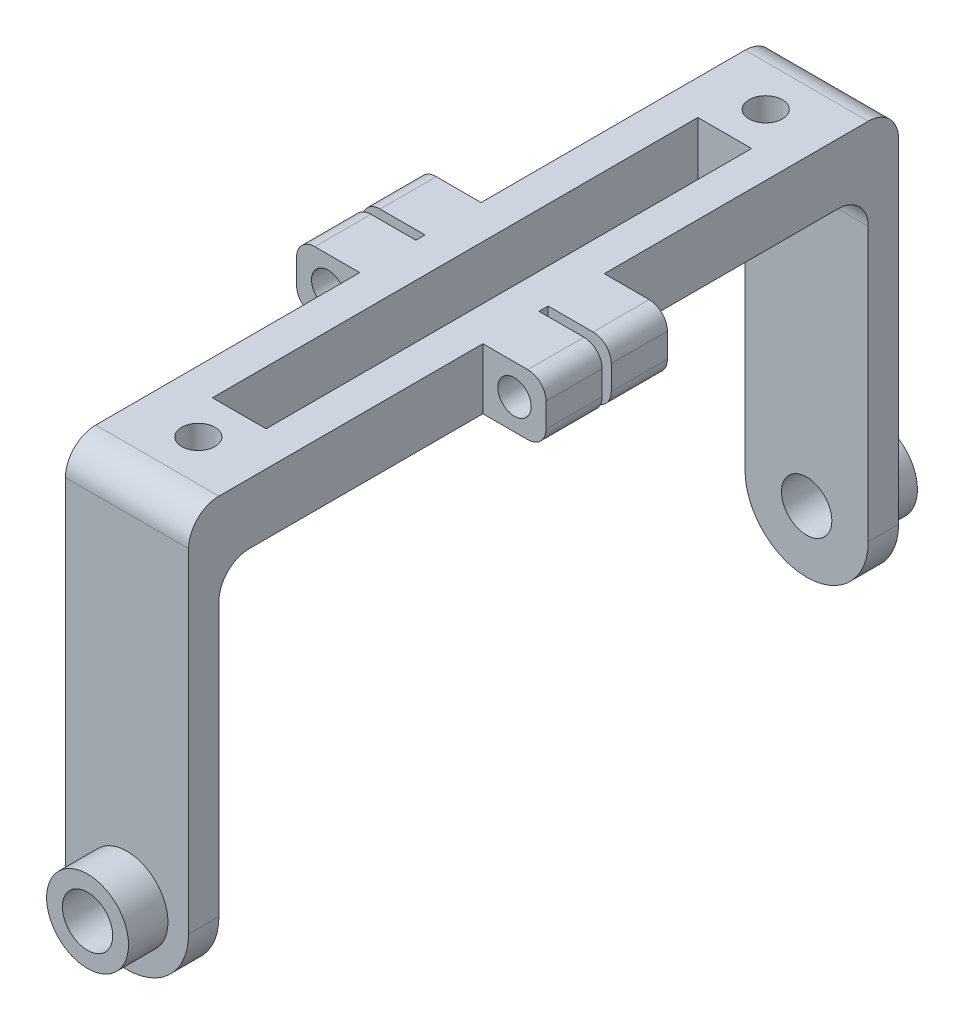
from build123d import *

# Parameters (mm, degrees)
SKETCH1_R               = 7.15
SKETCH1_R_2             = 4.15
BOSS_EXTRUDE1_DEPTH     = 5
SKETCH2_R               = 7.15
SKETCH2_R_2             = 4.15
BOSS_EXTRUDE2_DEPTH     = 5
BOSS_EXTRUDE3_START     = 1.5
SKETCH3_R               = 7.15
SKETCH3_R_2             = 4.15
BOSS_EXTRUDE3_DEPTH     = 1.5
SKETCH4_R               = 7.15
SKETCH4_R_2             = 4.15
BOSS_EXTRUDE4_DEPTH     = 1.5
SKETCH5_R               = 7.15
SKETCH5_R_2             = 4.15
BOSS_EXTRUDE5_DEPTH     = 5
BOSS_EXTRUDE6_START     = 5
SKETCH6_R               = 4.15
BOSS_EXTRUDE6_DEPTH     = 5
SKETCH7_W               = 20.3
SKETCH7_H               = 10
BOSS_EXTRUDE7_DEPTH     = 107
SKETCH8_R               = 4.15
CUT_EXTRUDE1_DEPTH      = 153.570131415
FILLET1_R               = 5
CUT_EXTRUDE3_DEPTH      = 18.9
SKETCH11_R              = 7.15
SKETCH11_R_2            = 6.75
CUT_EXTRUDE4_DEPTH      = 6.5
SKETCH12_R              = 7.15
SKETCH12_R_2            = 6.75
CUT_EXTRUDE5_DEPTH      = 6.5
CUT_EXTRUDE6_DEPTH      = 18.9
SKETCH14_W              = 9.25
SKETCH14_H              = 10
BOSS_EXTRUDE8_DEPTH     = 0.4
SKETCH15_W              = 9.25
SKETCH15_H              = 10
BOSS_EXTRUDE9_DEPTH     = 0.4
SKETCH17_W              = 9.25
SKETCH17_H              = 10
BOSS_EXTRUDE10_DEPTH    = 10
CUT_EXTRUDE7_DEPTH      = 26
SKETCH20_W              = 9.25
SKETCH20_H              = 10
BOSS_EXTRUDE11_DEPTH    = 10
CUT_EXTRUDE8_DEPTH      = 112.751968699
CUT_EXTRUDE8_DEPTH_BACK = 112.751968699
FILLET2_R               = 3
SKETCH23_W              = 117
SKETCH23_H              = 2
CUT_EXTRUDE9_DEPTH      = 37
SKETCH24_W              = 20.3
SKETCH24_H              = 5
BOSS_EXTRUDE12_DEPTH    = 22
SKETCH25_W              = 80
SKETCH25_H              = 10
CUT_EXTRUDE10_DEPTH     = 0.2
SKETCH26_W              = 80
SKETCH26_H              = 10
CUT_EXTRUDE11_DEPTH     = 0.2


with BuildPart() as part:
    # Sketch1 → Boss-Extrude1 (new body)
    with BuildSketch(Plane.XY):
        with Locations((-52, 0)):
            Circle(SKETCH1_R)
        with Locations((-52, 0)):
            Circle(SKETCH1_R_2, mode=Mode.SUBTRACT)
    extrude(amount=-BOSS_EXTRUDE1_DEPTH)

    # Sketch4 → Boss-Extrude4 (add)
    with BuildSketch(Plane(origin=(0, 0, -5), x_dir=(-1, 0, 0), z_dir=(0, 0, -1))):
        with Locations(Location((52, 0, 0), (0, 0, 180))):
            Circle(SKETCH4_R)
        with Locations(Location((52, 0, 0), (0, 0, 180))):
            Circle(SKETCH4_R_2, mode=Mode.SUBTRACT)
    extrude(amount=BOSS_EXTRUDE4_DEPTH)

    # Sketch5 → Boss-Extrude5 (add)
    # profile 1 of 6: a face of its own
    with BuildSketch(Plane(origin=(0, 0, -6.5), x_dir=(-1, 0, 0), z_dir=(0, 0, -1))):
        with Locations(Location((52, 0, 0), (0, 0, 180))):
            Circle(SKETCH5_R)
        with Locations(Location((52, 0, 0), (0, 0, 180))):
            Circle(SKETCH5_R_2, mode=Mode.SUBTRACT)
    # profile 2 of 6: a face of its own
    with BuildSketch(Plane(origin=(0, 0, -6.5), x_dir=(-1, 0, 0), z_dir=(0, 0, -1))):
        with BuildLine():
            ThreePointArc((44.85, 0), (52, 7.15), (59.15, 0))
            Line((59.15, 0), (62.15, 0))
            ThreePointArc((62.15, 0), (52, 10.15), (41.85, 0))
            Line((41.85, 0), (44.85, 0))
        make_face()
    # profile 3 of 6: a face of its own
    with BuildSketch(Plane(origin=(0, 0, -6.5), x_dir=(-1, 0, 0), z_dir=(0, 0, -1))):
        with BuildLine():
            Line((62.15, 0), (59.15, 0))
            ThreePointArc((59.15, 0), (52, -7.15), (44.85, 0))
            Line((44.85, 0), (41.85, 0))
            ThreePointArc((41.85, 0), (52, -10.15), (62.15, 0))
        make_face()
    # profile 4 of 6: a face of its own
    with BuildSketch(Plane(origin=(0, 0, -6.5), x_dir=(-1, 0, 0), z_dir=(0, 0, -1))):
        with BuildLine():
            ThreePointArc((44.85, 0), (52, 7.15), (59.15, 0))
            Line((59.15, 0), (62.15, 0))
            ThreePointArc((62.15, 0), (52, 10.15), (41.85, 0))
            Line((41.85, 0), (44.85, 0))
        make_face()
    # profile 5 of 6: a face of its own
    with BuildSketch(Plane(origin=(0, 0, -6.5), x_dir=(-1, 0, 0), z_dir=(0, 0, -1))):
        with BuildLine():
            Line((62.15, 0), (59.15, 0))
            ThreePointArc((59.15, 0), (52, -7.15), (44.85, 0))
            Line((44.85, 0), (41.85, 0))
            ThreePointArc((41.85, 0), (52, -10.15), (62.15, 0))
        make_face()
    # profile 6 of 6: a face of its own
    with BuildSketch(Plane(origin=(0, 0, -6.5), x_dir=(-1, 0, 0), z_dir=(0, 0, -1))):
        with BuildLine():
            ThreePointArc((41.85, 0), (52, 10.15), (62.15, 0))
            Line((62.15, 0), (62.15, 40))
            Line((62.15, 40), (41.85, 40))
            Line((41.85, 40), (41.85, 0))
        make_face()
    extrude(amount=BOSS_EXTRUDE5_DEPTH)



with BuildPart() as body_2:
    # Sketch2 → Boss-Extrude2 (new body)
    with BuildSketch(Plane.XY.offset(-125)):
        with Locations((-52, 0)):
            Circle(SKETCH2_R)
        with Locations((-52, 0)):
            Circle(SKETCH2_R_2, mode=Mode.SUBTRACT)
    extrude(amount=-BOSS_EXTRUDE2_DEPTH)

    # Sketch3 → Boss-Extrude3 (add)
    with BuildSketch(Plane.XY.offset(-125).offset(BOSS_EXTRUDE3_START)):
        with Locations((-52, 0)):
            Circle(SKETCH3_R)
        with Locations((-52, 0)):
            Circle(SKETCH3_R_2, mode=Mode.SUBTRACT)
    extrude(amount=-BOSS_EXTRUDE3_DEPTH)

    # Sketch6 → Boss-Extrude6 (add)
    with BuildSketch(Plane.XY.offset(-123.5).offset(BOSS_EXTRUDE6_START)):
        with BuildLine():
            Line((-62.15, 40), (-62.15, 0))
            ThreePointArc((-62.15, 0), (-52, -10.15), (-41.85, 0))
            Line((-41.85, 0), (-41.85, 40))
            Line((-41.85, 40), (-62.15, 40))
        make_face()
        with Locations((-52, 0)):
            Circle(SKETCH6_R, mode=Mode.SUBTRACT)
    extrude(amount=-BOSS_EXTRUDE6_DEPTH)


with BuildPart() as part_1:
    add(part.part)

    add(body_2.part)  # Boss-Extrude7 merges body 2
    # Sketch7 → Boss-Extrude7 (add)
    with BuildSketch(Plane.XY.offset(-118.5)):
        with Locations((-52, 35)):
            Rectangle(SKETCH7_W, SKETCH7_H)
    extrude(amount=BOSS_EXTRUDE7_DEPTH)

    # Sketch8 → Cut-Extrude1 (cut, through all)
    with BuildSketch(Plane(origin=(0, 40, 0), x_dir=(1, 0, 0), z_dir=(0, 1, 0))):
        with Locations(Location((-52, 65, 0), (0, 0, 270))):
            Circle(SKETCH8_R)
    extrude(amount=-CUT_EXTRUDE1_DEPTH, mode=Mode.SUBTRACT)

    # Fillet1
    fillet1_edges = [part_1.edges().sort_by_distance(p)[0] for p in [
        (-52, 40, -6.5),
        (-52, 30, -11.5),
        (-52, 30, -118.5),
        (-52, 40, -123.5),
    ]]
    fillet(fillet1_edges, radius=FILLET1_R)

    # Sketch10 → Cut-Extrude3 (cut)
    with BuildSketch(Plane(origin=(0, 40, 0), x_dir=(1, 0, 0), z_dir=(0, 1, 0))):
        with BuildLine():
            Line((-56.225, 65), (-56.225, 25))
            Line((-56.225, 25), (-47.775, 25))
            Line((-47.775, 25), (-47.775, 65))
            ThreePointArc((-47.775, 65), (-52, 60.775), (-56.225, 65))
        make_face()
        with BuildLine():
            Line((-56.225, 105), (-56.225, 65))
            ThreePointArc((-56.225, 65), (-52, 69.225), (-47.775, 65))
            Line((-47.775, 65), (-47.775, 105))
            Line((-47.775, 105), (-56.225, 105))
        make_face()
    extrude(amount=-CUT_EXTRUDE3_DEPTH, mode=Mode.SUBTRACT)


with BuildPart() as cut_extrude3_kept_piece:
    # of the separate pieces the step leaves, the one the design keeps (cut_extrude3_pieces_kept)
    add(part_1.part.solids().sort_by_distance((-41.85, 35, -123.5))[0])

    # Sketch11 → Cut-Extrude4 (cut)
    with BuildSketch(Plane.XY):
        with Locations((-52, 0)):
            Circle(SKETCH11_R)
        with Locations((-52, 0)):
            Circle(SKETCH11_R_2, mode=Mode.SUBTRACT)
    extrude(amount=-CUT_EXTRUDE4_DEPTH, mode=Mode.SUBTRACT)

    # Sketch12 → Cut-Extrude5 (cut)
    with BuildSketch(Plane(origin=(0, 0, -130), x_dir=(-1, 0, 0), z_dir=(0, 0, -1))):
        with Locations((52, 0)):
            Circle(SKETCH12_R)
        with Locations(Location((52, 0, 0), (0, 0, 180))):
            Circle(SKETCH12_R_2, mode=Mode.SUBTRACT)
    extrude(amount=-CUT_EXTRUDE5_DEPTH, mode=Mode.SUBTRACT)

    # Sketch13 → Cut-Extrude6 (cut)
    with BuildSketch(Plane(origin=(0, 40, 0), x_dir=(1, 0, 0), z_dir=(0, 1, 0))):
        with BuildLine():
            ThreePointArc((-52, 21), (-54.75, 18.25), (-52, 15.5))
            Line((-52, 15.5), (-52, 21))
        make_face()
        with BuildLine():
            Line((-52, 21), (-52, 15.5))
            ThreePointArc((-52, 15.5), (-50.055456352, 16.305456352), (-49.25, 18.25))
            ThreePointArc((-49.25, 18.25), (-50.055456352, 20.194543648), (-52, 21))
        make_face()
        with BuildLine():
            ThreePointArc((-52, 114.5), (-54.75, 111.75), (-52, 109))
            Line((-52, 109), (-52, 114.5))
        make_face()
        with BuildLine():
            Line((-52, 114.5), (-52, 109))
            ThreePointArc((-52, 109), (-50.055456352, 109.805456352), (-49.25, 111.75))
            ThreePointArc((-49.25, 111.75), (-50.055456352, 113.694543648), (-52, 114.5))
        make_face()
    extrude(amount=-CUT_EXTRUDE6_DEPTH, mode=Mode.SUBTRACT)

    # Sketch14 → Boss-Extrude8 (add)
    with BuildSketch(Plane(origin=(-41.85, 0, 0), x_dir=(0, 0, -1), z_dir=(1, 0, 0))):
        with Locations((59.625, 35)):
            Rectangle(SKETCH14_W, SKETCH14_H)
        with Locations((70.375, 35)):
            Rectangle(SKETCH14_W, SKETCH14_H)
    extrude(amount=BOSS_EXTRUDE8_DEPTH)

    # Sketch15 → Boss-Extrude9 (add)
    with BuildSketch(Plane.ZY.offset(62.15)):
        with Locations((-59.625, 35)):
            Rectangle(SKETCH15_W, SKETCH15_H)
        with Locations((-70.375, 35)):
            Rectangle(SKETCH15_W, SKETCH15_H)
    extrude(amount=BOSS_EXTRUDE9_DEPTH)

    # Sketch17 → Boss-Extrude10 (add)
    with BuildSketch(Plane(origin=(-41.45, 0, 0), x_dir=(0, 0, -1), z_dir=(1, 0, 0))):
        with Locations((59.625, 35)):
            Rectangle(SKETCH17_W, SKETCH17_H)
        with Locations((70.375, 35)):
            Rectangle(SKETCH17_W, SKETCH17_H)
    extrude(amount=BOSS_EXTRUDE10_DEPTH)

    # Sketch18 → Cut-Extrude7 (cut)
    with BuildSketch(Plane(origin=(0, 0, -75), x_dir=(-1, 0, 0), z_dir=(0, 0, -1))):
        with BuildLine():
            ThreePointArc((39.4, 35), (36.65, 37.75), (33.9, 35))
            Line((33.9, 35), (39.4, 35))
        make_face()
        with BuildLine():
            Line((39.4, 35), (33.9, 35))
            ThreePointArc((33.9, 35), (36.65, 32.25), (39.4, 35))
        make_face()
    extrude(amount=-CUT_EXTRUDE7_DEPTH, mode=Mode.SUBTRACT)

    # Sketch20 → Boss-Extrude11 (add)
    with BuildSketch(Plane.ZY.offset(62.55)):
        with Locations((-70.375, 35)):
            Rectangle(SKETCH20_W, SKETCH20_H)
        with Locations((-59.625, 35)):
            Rectangle(SKETCH20_W, SKETCH20_H)
    extrude(amount=BOSS_EXTRUDE11_DEPTH)

    # Sketch21 → Cut-Extrude8 (cut, two sides: drawn at the far end of the back side and taken through both)
    with BuildSketch(Plane(origin=(0, 0, -75), x_dir=(-1, 0, 0), z_dir=(0, 0, -1)).offset(-CUT_EXTRUDE8_DEPTH_BACK)):
        with BuildLine():
            ThreePointArc((64.6, 35), (67.35, 32.25), (70.1, 35))
            Line((70.1, 35), (64.6, 35))
        make_face()
        with BuildLine():
            Line((64.6, 35), (70.1, 35))
            ThreePointArc((70.1, 35), (67.35, 37.75), (64.6, 35))
        make_face()
    extrude(amount=CUT_EXTRUDE8_DEPTH + CUT_EXTRUDE8_DEPTH_BACK, mode=Mode.SUBTRACT)

    # Fillet2
    fillet2_edges = [cut_extrude3_kept_piece.edges().sort_by_distance(p)[0] for p in [
        (-31.45, 40, -59.625),
        (-31.45, 30, -59.625),
        (-31.45, 30, -70.375),
        (-31.45, 40, -70.375),
        (-72.55, 30, -70.375),
        (-72.55, 40, -70.375),
        (-72.55, 40, -59.625),
        (-72.55, 30, -59.625),
    ]]
    fillet(fillet2_edges, radius=FILLET2_R)

    # Sketch23 → Cut-Extrude9 (cut)
    with BuildSketch(Plane(origin=(-41.85, 0, 0), x_dir=(0, 0, -1), z_dir=(1, 0, 0))):
        with Locations((65, 18.5)):
            Rectangle(SKETCH23_W, SKETCH23_H)
    extrude(amount=-CUT_EXTRUDE9_DEPTH, mode=Mode.SUBTRACT)


with BuildPart() as cut_extrude9_piece_1:
    # of the separate pieces the step leaves, piece 1, a body of its own (cut_extrude9_pieces)
    add(cut_extrude3_kept_piece.part.solids().sort_by_distance((-34.45, 30, -75))[0])


with BuildPart() as cut_extrude9_piece_2:
    # of the separate pieces the step leaves, piece 2, a body of its own (cut_extrude9_pieces)
    add(cut_extrude3_kept_piece.part.solids().sort_by_distance((-41.85, 0, -118.5))[0])


with BuildPart() as cut_extrude9_piece_3:
    # of the separate pieces the step leaves, piece 3, a body of its own (cut_extrude9_pieces)
    add(cut_extrude3_kept_piece.part.solids().sort_by_distance((-41.85, 17.5, -6.5))[0])


with BuildPart() as cut_extrude9_piece_1_1:
    # Body-Move/Copy1: moved
    add(cut_extrude9_piece_1.part.moved(Location((0, 20, 0))))


    add(cut_extrude9_piece_2.part)  # Boss-Extrude12 merges Cut-Extrude9 piece 2

    add(cut_extrude9_piece_3.part)  # Boss-Extrude12 merges Cut-Extrude9 piece 3
    # Sketch24 → Boss-Extrude12 (add)
    with BuildSketch(Plane(origin=(0, 17.5, 0), x_dir=(1, 0, 0), z_dir=(0, 1, 0))):
        with Locations((-52, 9)):
            Rectangle(SKETCH24_W, SKETCH24_H)
        with Locations((-52, 121)):
            Rectangle(SKETCH24_W, SKETCH24_H)
    extrude(amount=BOSS_EXTRUDE12_DEPTH)

    # Sketch25 → Cut-Extrude10 (cut)
    with BuildSketch(Plane(origin=(-56.225, 0, 0), x_dir=(0, 0, -1), z_dir=(1, 0, 0))):
        with Locations((65, 55)):
            Rectangle(SKETCH25_W, SKETCH25_H)
    extrude(amount=-CUT_EXTRUDE10_DEPTH, mode=Mode.SUBTRACT)

    # Sketch26 → Cut-Extrude11 (cut)
    with BuildSketch(Plane.ZY.offset(47.775)):
        with Locations((-65, 55)):
            Rectangle(SKETCH26_W, SKETCH26_H)
    extrude(amount=-CUT_EXTRUDE11_DEPTH, mode=Mode.SUBTRACT)


solid = cut_extrude9_piece_1_1.part
